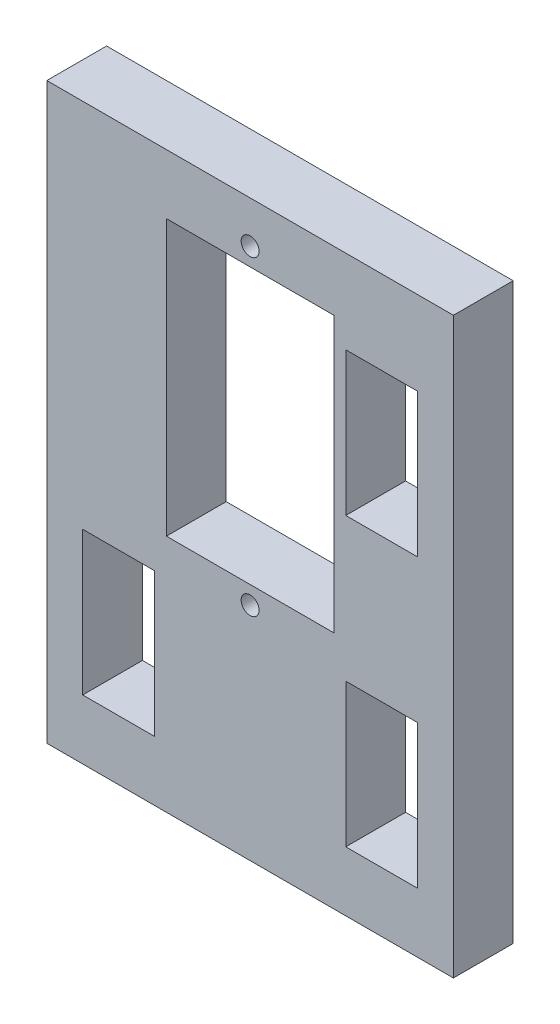
from build123d import *

# Parameters (mm, degrees)
CROQUIS1_W              = 34
CROQUIS1_H              = 48
CROQUIS1_R              = 0.75
CROQUIS1_W_2            = 14
CROQUIS1_H_2            = 23
CROQUIS1_W_3            = 6
CROQUIS1_H_3            = 12
SALIENTE_EXTRUIR1_DEPTH = 5


with BuildPart() as part:
    # Croquis1 → Saliente-Extruir1 (new body)
    with BuildSketch(Plane.XY):
        with Locations((17, 24)):
            Rectangle(CROQUIS1_W, CROQUIS1_H)
        with Locations((17, 18.5)):
            Circle(CROQUIS1_R, mode=Mode.SUBTRACT)
        with Locations((17, 44.5)):
            Circle(CROQUIS1_R, mode=Mode.SUBTRACT)
        with Locations((17, 31.5)):
            Rectangle(CROQUIS1_W_2, CROQUIS1_H_2, mode=Mode.SUBTRACT)
        with Locations((28, 11)):
            Rectangle(CROQUIS1_W_3, CROQUIS1_H_3, mode=Mode.SUBTRACT)
        with Locations((28, 35)):
            Rectangle(CROQUIS1_W_3, CROQUIS1_H_3, mode=Mode.SUBTRACT)
        with Locations((6, 11)):
            Rectangle(CROQUIS1_W_3, CROQUIS1_H_3, mode=Mode.SUBTRACT)
    extrude(amount=SALIENTE_EXTRUIR1_DEPTH)


solid = part.part
